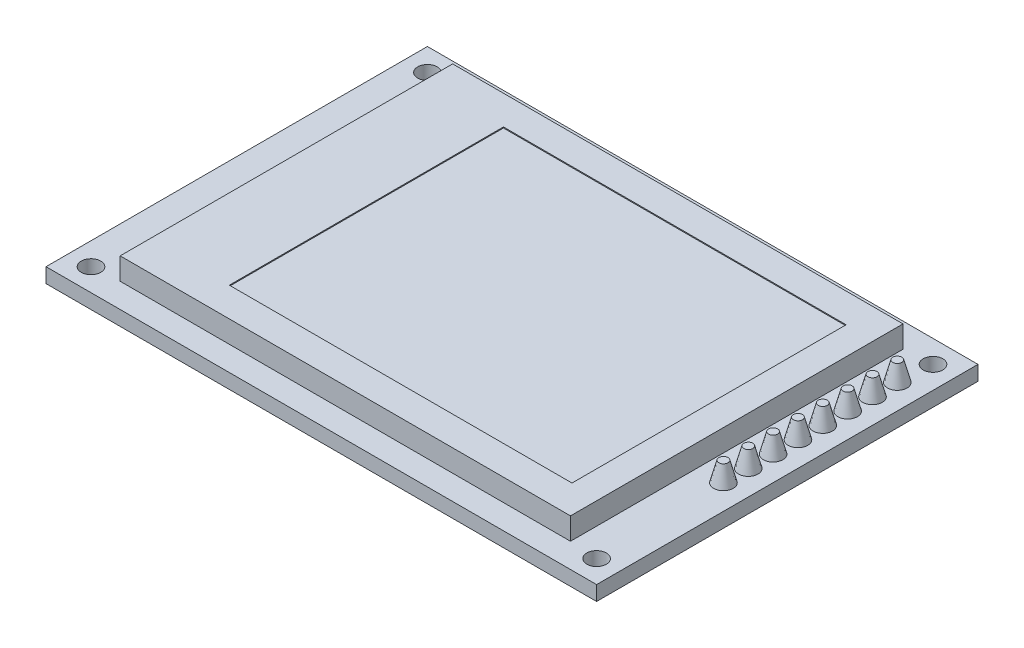
from build123d import *

# Parameters (mm, degrees)
SKETCH_1_W                = 56.3
SKETCH_1_H                = 39
SKETCH_1_R                = 1
EXTRUDE_1_DEPTH           = 1.5
SKETCH_2_W                = 46.047970844
SKETCH_2_H                = 34
EXTRUDE_2_DEPTH           = 2.25
SKETCH_3_W                = 35.04
SKETCH_3_H                = 28.03
CUT_EXTRUDE_1_DEPTH       = 0.1
SKETCH_5_R                = 1
EXTRUDE_4_DEPTH           = 2
EXTRUDE_4_DRAFT           = 15
EXTRUDE_4_PROFILE_2_DEPTH = 2
EXTRUDE_4_PROFILE_2_DRAFT = 15
EXTRUDE_4_PROFILE_3_DEPTH = 2
EXTRUDE_4_PROFILE_3_DRAFT = 15
EXTRUDE_4_PROFILE_4_DEPTH = 2
EXTRUDE_4_PROFILE_4_DRAFT = 15
EXTRUDE_4_PROFILE_5_DEPTH = 2
EXTRUDE_4_PROFILE_5_DRAFT = 15
EXTRUDE_4_PROFILE_6_DEPTH = 2
EXTRUDE_4_PROFILE_6_DRAFT = 15
EXTRUDE_4_PROFILE_7_DEPTH = 2
EXTRUDE_4_PROFILE_7_DRAFT = 15
EXTRUDE_4_PROFILE_8_DEPTH = 2
EXTRUDE_4_PROFILE_8_DRAFT = 15


with BuildPart() as part:
    # Эскиз1 → Бобышка-Вытянуть1 (new body)
    with BuildSketch(Plane(origin=(0, 0, 0), x_dir=(1, 0, 0), z_dir=(0, 1, 0))):
        with Locations((-2.63, -1.52)):
            Rectangle(SKETCH_1_W, SKETCH_1_H)
        with Locations(Location((-28.48, 15.68, 0), (0, 0, 270))):
            Circle(SKETCH_1_R, mode=Mode.SUBTRACT)
        with Locations(Location((23.22, 15.68, 0), (0, 0, 270))):
            Circle(SKETCH_1_R, mode=Mode.SUBTRACT)
        with Locations(Location((-28.48, -18.72, 0), (0, 0, 270))):
            Circle(SKETCH_1_R, mode=Mode.SUBTRACT)
        with Locations(Location((23.22, -18.72, 0), (0, 0, 270))):
            Circle(SKETCH_1_R, mode=Mode.SUBTRACT)
    extrude(amount=EXTRUDE_1_DEPTH)

    # Эскиз2 → Бобышка-Вытянуть2 (add)
    with BuildSketch(Plane(origin=(0, 1.5, 0), x_dir=(1, 0, 0), z_dir=(0, 1, 0))):
        with Locations((-2.673985422, -1.52)):
            Rectangle(SKETCH_2_W, SKETCH_2_H)
    extrude(amount=EXTRUDE_2_DEPTH)

    # Эскиз3 → Вырез-Вытянуть1 (cut)
    with BuildSketch(Plane(origin=(0, 3.75, 0), x_dir=(1, 0, 0), z_dir=(0, 1, 0))):
        with Locations((0, -1.52)):
            Rectangle(SKETCH_3_W, SKETCH_3_H)
    extrude(amount=-CUT_EXTRUDE_1_DEPTH, mode=Mode.SUBTRACT)


with BuildPart() as extrude_4_tool:
    # Эскиз5 → Бобышка-Вытянуть4 (with draft: the straight prism first)
    with BuildSketch(Plane(origin=(0, 1.5, 0), x_dir=(1, 0, 0), z_dir=(0, 1, 0))):
        with Locations((22.99, 12.26)):
            Circle(SKETCH_5_R)
    extrude(amount=EXTRUDE_4_DEPTH)
    # Бобышка-Вытянуть4: the draft: its side faces are tilted about the plane it starts from
    extrude_4_sides = [extrude_4_tool.faces().sort_by_distance(p)[0] for p in [
        (21.99, 2.5, -12.26),
    ]]
    draft(extrude_4_sides, Plane(origin=(0, 1.5, 0), x_dir=(1, 0, 0), z_dir=(0, 1, 0)), EXTRUDE_4_DRAFT)


with BuildPart() as part_1:
    add(part.part)

    # Бобышка-Вытянуть4: add extrude_4_tool
    add(extrude_4_tool.part)


with BuildPart() as extrude_4_profile_2_tool:
    # Эскиз5 → Бобышка-Вытянуть4 profile 2 (with draft: the straight prism first)
    with BuildSketch(Plane(origin=(0, 1.5, 0), x_dir=(1, 0, 0), z_dir=(0, 1, 0))):
        with Locations((22.99, 9.72)):
            Circle(SKETCH_5_R)
    extrude(amount=EXTRUDE_4_PROFILE_2_DEPTH)
    # Бобышка-Вытянуть4 profile 2: the draft: its side faces are tilted about the plane it starts from
    extrude_4_profile_2_sides = [extrude_4_profile_2_tool.faces().sort_by_distance(p)[0] for p in [
        (21.99, 2.5, -9.72),
    ]]
    draft(extrude_4_profile_2_sides, Plane(origin=(0, 1.5, 0), x_dir=(1, 0, 0), z_dir=(0, 1, 0)), EXTRUDE_4_PROFILE_2_DRAFT)


with BuildPart() as part_2:
    add(part_1.part)

    # Бобышка-Вытянуть4 profile 2: add extrude_4_profile_2_tool
    add(extrude_4_profile_2_tool.part)


with BuildPart() as extrude_4_profile_3_tool:
    # Эскиз5 → Бобышка-Вытянуть4 profile 3 (with draft: the straight prism first)
    with BuildSketch(Plane(origin=(0, 1.5, 0), x_dir=(1, 0, 0), z_dir=(0, 1, 0))):
        with Locations((22.99, 7.18)):
            Circle(SKETCH_5_R)
    extrude(amount=EXTRUDE_4_PROFILE_3_DEPTH)
    # Бобышка-Вытянуть4 profile 3: the draft: its side faces are tilted about the plane it starts from
    extrude_4_profile_3_sides = [extrude_4_profile_3_tool.faces().sort_by_distance(p)[0] for p in [
        (21.99, 2.5, -7.18),
    ]]
    draft(extrude_4_profile_3_sides, Plane(origin=(0, 1.5, 0), x_dir=(1, 0, 0), z_dir=(0, 1, 0)), EXTRUDE_4_PROFILE_3_DRAFT)


with BuildPart() as part_3:
    add(part_2.part)

    # Бобышка-Вытянуть4 profile 3: add extrude_4_profile_3_tool
    add(extrude_4_profile_3_tool.part)


with BuildPart() as extrude_4_profile_4_tool:
    # Эскиз5 → Бобышка-Вытянуть4 profile 4 (with draft: the straight prism first)
    with BuildSketch(Plane(origin=(0, 1.5, 0), x_dir=(1, 0, 0), z_dir=(0, 1, 0))):
        with Locations((22.99, 4.64)):
            Circle(SKETCH_5_R)
    extrude(amount=EXTRUDE_4_PROFILE_4_DEPTH)
    # Бобышка-Вытянуть4 profile 4: the draft: its side faces are tilted about the plane it starts from
    extrude_4_profile_4_sides = [extrude_4_profile_4_tool.faces().sort_by_distance(p)[0] for p in [
        (21.99, 2.5, -4.64),
    ]]
    draft(extrude_4_profile_4_sides, Plane(origin=(0, 1.5, 0), x_dir=(1, 0, 0), z_dir=(0, 1, 0)), EXTRUDE_4_PROFILE_4_DRAFT)


with BuildPart() as part_4:
    add(part_3.part)

    # Бобышка-Вытянуть4 profile 4: add extrude_4_profile_4_tool
    add(extrude_4_profile_4_tool.part)


with BuildPart() as extrude_4_profile_5_tool:
    # Эскиз5 → Бобышка-Вытянуть4 profile 5 (with draft: the straight prism first)
    with BuildSketch(Plane(origin=(0, 1.5, 0), x_dir=(1, 0, 0), z_dir=(0, 1, 0))):
        with Locations((22.99, 2.1)):
            Circle(SKETCH_5_R)
    extrude(amount=EXTRUDE_4_PROFILE_5_DEPTH)
    # Бобышка-Вытянуть4 profile 5: the draft: its side faces are tilted about the plane it starts from
    extrude_4_profile_5_sides = [extrude_4_profile_5_tool.faces().sort_by_distance(p)[0] for p in [
        (21.99, 2.5, -2.1),
    ]]
    draft(extrude_4_profile_5_sides, Plane(origin=(0, 1.5, 0), x_dir=(1, 0, 0), z_dir=(0, 1, 0)), EXTRUDE_4_PROFILE_5_DRAFT)


with BuildPart() as part_5:
    add(part_4.part)

    # Бобышка-Вытянуть4 profile 5: add extrude_4_profile_5_tool
    add(extrude_4_profile_5_tool.part)


with BuildPart() as extrude_4_profile_6_tool:
    # Эскиз5 → Бобышка-Вытянуть4 profile 6 (with draft: the straight prism first)
    with BuildSketch(Plane(origin=(0, 1.5, 0), x_dir=(1, 0, 0), z_dir=(0, 1, 0))):
        with Locations((22.99, -0.44)):
            Circle(SKETCH_5_R)
    extrude(amount=EXTRUDE_4_PROFILE_6_DEPTH)
    # Бобышка-Вытянуть4 profile 6: the draft: its side faces are tilted about the plane it starts from
    extrude_4_profile_6_sides = [extrude_4_profile_6_tool.faces().sort_by_distance(p)[0] for p in [
        (21.99, 2.5, 0.44),
    ]]
    draft(extrude_4_profile_6_sides, Plane(origin=(0, 1.5, 0), x_dir=(1, 0, 0), z_dir=(0, 1, 0)), EXTRUDE_4_PROFILE_6_DRAFT)


with BuildPart() as part_6:
    add(part_5.part)

    # Бобышка-Вытянуть4 profile 6: add extrude_4_profile_6_tool
    add(extrude_4_profile_6_tool.part)


with BuildPart() as extrude_4_profile_7_tool:
    # Эскиз5 → Бобышка-Вытянуть4 profile 7 (with draft: the straight prism first)
    with BuildSketch(Plane(origin=(0, 1.5, 0), x_dir=(1, 0, 0), z_dir=(0, 1, 0))):
        with Locations((22.99, -2.98)):
            Circle(SKETCH_5_R)
    extrude(amount=EXTRUDE_4_PROFILE_7_DEPTH)
    # Бобышка-Вытянуть4 profile 7: the draft: its side faces are tilted about the plane it starts from
    extrude_4_profile_7_sides = [extrude_4_profile_7_tool.faces().sort_by_distance(p)[0] for p in [
        (21.99, 2.5, 2.98),
    ]]
    draft(extrude_4_profile_7_sides, Plane(origin=(0, 1.5, 0), x_dir=(1, 0, 0), z_dir=(0, 1, 0)), EXTRUDE_4_PROFILE_7_DRAFT)


with BuildPart() as part_7:
    add(part_6.part)

    # Бобышка-Вытянуть4 profile 7: add extrude_4_profile_7_tool
    add(extrude_4_profile_7_tool.part)


with BuildPart() as extrude_4_profile_8_tool:
    # Эскиз5 → Бобышка-Вытянуть4 profile 8 (with draft: the straight prism first)
    with BuildSketch(Plane(origin=(0, 1.5, 0), x_dir=(1, 0, 0), z_dir=(0, 1, 0))):
        with Locations((22.99, -5.52)):
            Circle(SKETCH_5_R)
    extrude(amount=EXTRUDE_4_PROFILE_8_DEPTH)
    # Бобышка-Вытянуть4 profile 8: the draft: its side faces are tilted about the plane it starts from
    extrude_4_profile_8_sides = [extrude_4_profile_8_tool.faces().sort_by_distance(p)[0] for p in [
        (21.99, 2.5, 5.52),
    ]]
    draft(extrude_4_profile_8_sides, Plane(origin=(0, 1.5, 0), x_dir=(1, 0, 0), z_dir=(0, 1, 0)), EXTRUDE_4_PROFILE_8_DRAFT)


with BuildPart() as part_8:
    add(part_7.part)

    # Бобышка-Вытянуть4 profile 8: add extrude_4_profile_8_tool
    add(extrude_4_profile_8_tool.part)


solid = part_8.part
